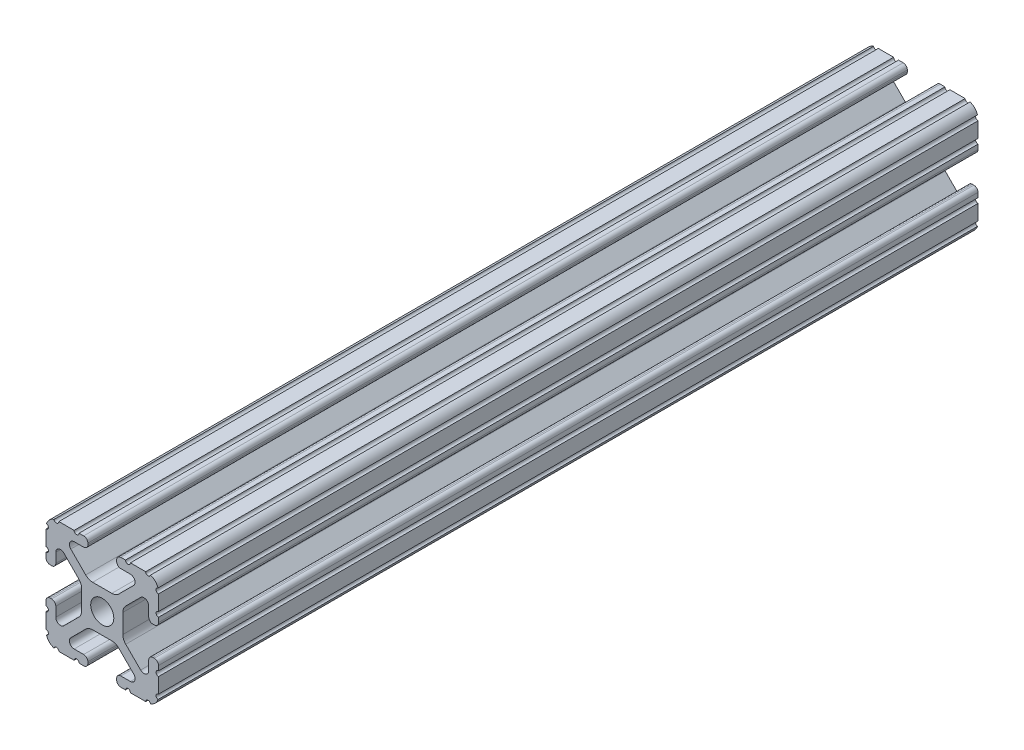
from build123d import *

# Parameters (mm, degrees)
BOSS_EXTRUDE1_START     = -92.507115
BOSS_EXTRUDE1_DEPTH     = 185.01423
CUT_EXTRUDE1_DEPTH      = 95.234528309
CUT_EXTRUDE1_DEPTH_BACK = 95.234528309
SKETCH5_R               = 0.55245


with BuildPart() as part:
    # Sketch4 → Boss-Extrude1 (new body)
    with BuildSketch(Plane.XY.offset(BOSS_EXTRUDE1_START)):
        with BuildLine():
            Line((4.190365, -12.7), (10.11729625, -12.7))
            ThreePointArc((10.11729625, -12.7), (11.943543585, -11.943543585), (12.7, -10.11729625))
            Line((12.7, -10.11729625), (12.7, -4.190365))
            ThreePointArc((12.7, -4.190365), (12.42492494, -3.52627506), (11.760835, -3.2512))
            Line((11.760835, -3.2512), (11.429365, -3.2512))
            ThreePointArc((11.429365, -3.2512), (10.76527506, -3.52627506), (10.4902, -4.190365))
            Line((10.4902, -4.190365), (10.4902, -6.348478019))
            ThreePointArc((10.4902, -6.348478019), (9.830707141, -7.335478831), (8.666460301, -7.103895736))
            Line((8.666460301, -7.103895736), (5.299899128, -3.737334563))
            ThreePointArc((5.299899128, -3.737334563), (4.817571085, -3.015479634), (4.6482, -2.16399369))
            Line((4.6482, -2.16399369), (4.6482, 0))
            Line((4.6482, 0), (2.6035, 0))
            ThreePointArc((2.6035, 0), (1.840952505, -1.840952505), (0, -2.6035))
            Line((0, -2.6035), (0, -4.6482))
            Line((0, -4.6482), (2.16399369, -4.6482))
            ThreePointArc((2.16399369, -4.6482), (3.015479634, -4.817571085), (3.737334563, -5.299899128))
            Line((3.737334563, -5.299899128), (7.103895736, -8.666460301))
            ThreePointArc((7.103895736, -8.666460301), (7.335478831, -9.830707141), (6.348478019, -10.4902))
            Line((6.348478019, -10.4902), (4.190365, -10.4902))
            ThreePointArc((4.190365, -10.4902), (3.52627506, -10.76527506), (3.2512, -11.429365))
            Line((3.2512, -11.429365), (3.2512, -11.760835))
            ThreePointArc((3.2512, -11.760835), (3.52627506, -12.42492494), (4.190365, -12.7))
        make_face()
    extrude(amount=BOSS_EXTRUDE1_DEPTH)

    # Sketch5 → Cut-Extrude1 (cut, two sides: drawn at the far end of the back side and taken through both)
    with BuildSketch(Plane.XY.offset(-CUT_EXTRUDE1_DEPTH_BACK)):
        with Locations((10.356153152, -12.7)):
            Circle(SKETCH5_R)
        with Locations((5.796028019, -12.7)):
            Circle(SKETCH5_R)
        with Locations((12.7, -10.356153152)):
            Circle(SKETCH5_R)
        with Locations((12.7, -5.796028019)):
            Circle(SKETCH5_R)
    extrude(amount=CUT_EXTRUDE1_DEPTH + CUT_EXTRUDE1_DEPTH_BACK, mode=Mode.SUBTRACT)

    # Mirror1: part across plane


with BuildPart() as part_1:
    add(part.part)
    add(part.part.mirror(Plane(origin=(0, 0, 0), x_dir=(0, 0, 1), z_dir=(1, 0, 0))))

    # Mirror2: part across plane


with BuildPart() as part_2:
    add(part_1.part)
    add(part_1.part.mirror(Plane.ZX))


solid = part_2.part
